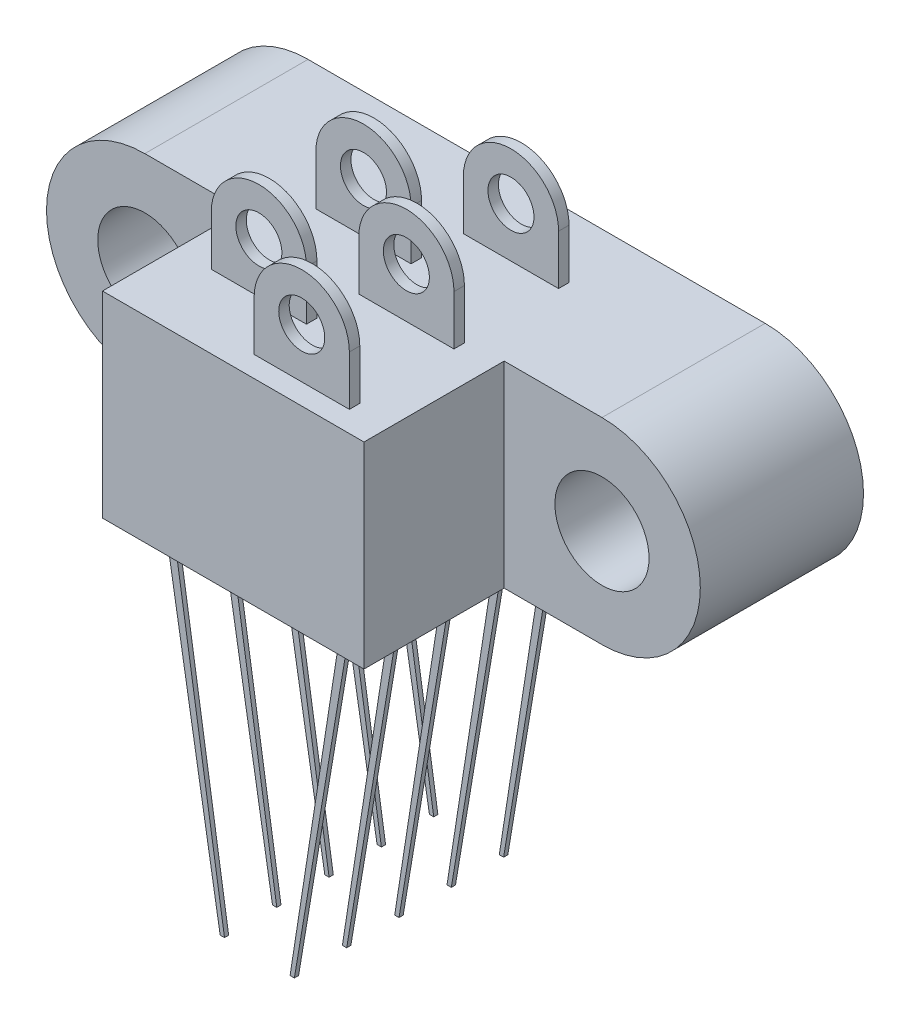
from build123d import *

# Parameters (mm, degrees)
SKETCH1_R                 = 1.143
BOSS_EXTRUDE1_DEPTH       = 3.9624
SKETCH2_W                 = 6.35
SKETCH2_H                 = 4.7752
BOSS_EXTRUDE2_DEPTH       = 3.4036
BOSS_EXTRUDE3_DEPTH       = 0.127
BOSS_EXTRUDE3_DEPTH_BACK  = 0.127
SKETCH3_R                 = 0.5588
BOSS_EXTRUDE4_DEPTH       = 0.127
BOSS_EXTRUDE4_DEPTH_BACK  = 0.127
SKETCH4_R                 = 0.5588
BOSS_EXTRUDE5_DEPTH       = 0.127
BOSS_EXTRUDE5_DEPTH_BACK  = 0.127
SKETCH5_R                 = 0.5588
BOSS_EXTRUDE6_DEPTH       = 0.127
BOSS_EXTRUDE6_DEPTH_BACK  = 0.127
SKETCH7_R                 = 0.5588
BOSS_EXTRUDE7_DEPTH       = 0.127
BOSS_EXTRUDE7_DEPTH_BACK  = 0.127
SKETCH6_R                 = 0.5588
BOSS_EXTRUDE8_DEPTH       = 0.0508
BOSS_EXTRUDE8_DEPTH_BACK  = 0.0508
BOSS_EXTRUDE11_DEPTH      = 0.0508
BOSS_EXTRUDE11_DEPTH_BACK = 0.0508
BOSS_EXTRUDE12_DEPTH      = 0.0508
BOSS_EXTRUDE12_DEPTH_BACK = 0.0508
BOSS_EXTRUDE13_DEPTH      = 0.0508
BOSS_EXTRUDE13_DEPTH_BACK = 0.0508
BOSS_EXTRUDE14_DEPTH      = 0.0508
BOSS_EXTRUDE14_DEPTH_BACK = 0.0508


with BuildPart() as part:
    # Sketch1 → Boss-Extrude1 (new body)
    with BuildSketch(Plane.XY):
        with BuildLine():
            Line((-5.5499, 2.3876), (5.5499, 2.3876))
            ThreePointArc((5.5499, 2.3876), (7.9375, 0), (5.5499, -2.3876))
            Line((5.5499, -2.3876), (-5.5499, -2.3876))
            ThreePointArc((-5.5499, -2.3876), (-7.9375, 0), (-5.5499, 2.3876))
        make_face()
        with Locations((-5.5499, 0)):
            Circle(SKETCH1_R, mode=Mode.SUBTRACT)
        with Locations((5.5499, 0)):
            Circle(SKETCH1_R, mode=Mode.SUBTRACT)
    extrude(amount=BOSS_EXTRUDE1_DEPTH)

    # Sketch2 → Boss-Extrude2 (add)
    with BuildSketch(Plane.XY.offset(3.9624)):
        Rectangle(SKETCH2_W, SKETCH2_H)
    extrude(amount=BOSS_EXTRUDE2_DEPTH)

    # Sketch3 → Boss-Extrude3 (add, two sides: drawn at the far end of the back side and taken through both)
    with BuildSketch(Plane(origin=(0, 0, 1.651), x_dir=(-1, 0, 0), z_dir=(0, 0, -1)).offset(-BOSS_EXTRUDE3_DEPTH_BACK)):
        with BuildLine():
            Line((-2.3114, 3.5941), (-2.3114, 2.3876))
            Line((-2.3114, 2.3876), (0, 2.3876))
            Line((0, 2.3876), (0, 3.5941))
            ThreePointArc((0, 3.5941), (-1.1557, 4.7498), (-2.3114, 3.5941))
        make_face()
        with Locations((-1.1557, 3.5941)):
            Circle(SKETCH3_R, mode=Mode.SUBTRACT)
    extrude(amount=BOSS_EXTRUDE3_DEPTH + BOSS_EXTRUDE3_DEPTH_BACK)

    # Sketch4 → Boss-Extrude4 (add, two sides: drawn at the far end of the back side and taken through both)
    with BuildSketch(Plane(origin=(0, 0, 2.921), x_dir=(-1, 0, 0), z_dir=(0, 0, -1)).offset(-BOSS_EXTRUDE4_DEPTH_BACK)):
        with BuildLine():
            Line((2.3114, 3.5941), (2.3114, 2.3876))
            Line((2.3114, 2.3876), (0, 2.3876))
            Line((0, 2.3876), (0, 3.5941))
            ThreePointArc((0, 3.5941), (1.1557, 4.7498), (2.3114, 3.5941))
        make_face()
        with Locations(Location((1.1557, 3.5941, 0), (0, 0, 180))):
            Circle(SKETCH4_R, mode=Mode.SUBTRACT)
    extrude(amount=BOSS_EXTRUDE4_DEPTH + BOSS_EXTRUDE4_DEPTH_BACK)

    # Sketch5 → Boss-Extrude5 (add, two sides: drawn at the far end of the back side and taken through both)
    with BuildSketch(Plane(origin=(0, 0, 4.191), x_dir=(-1, 0, 0), z_dir=(0, 0, -1)).offset(-BOSS_EXTRUDE5_DEPTH_BACK)):
        with BuildLine():
            Line((-2.3114, 3.5941), (-2.3114, 2.3876))
            Line((-2.3114, 2.3876), (0, 2.3876))
            Line((0, 2.3876), (0, 3.5941))
            ThreePointArc((0, 3.5941), (-1.1557, 4.7498), (-2.3114, 3.5941))
        make_face()
        with Locations((-1.1557, 3.5941)):
            Circle(SKETCH5_R, mode=Mode.SUBTRACT)
    extrude(amount=BOSS_EXTRUDE5_DEPTH + BOSS_EXTRUDE5_DEPTH_BACK)

    # Sketch7 → Boss-Extrude6 (add, two sides: drawn at the far end of the back side and taken through both)
    with BuildSketch(Plane(origin=(0, 0, 5.461), x_dir=(-1, 0, 0), z_dir=(0, 0, -1)).offset(-BOSS_EXTRUDE6_DEPTH_BACK)):
        with BuildLine():
            Line((2.3114, 2.3876), (2.3114, 3.5941))
            ThreePointArc((2.3114, 3.5941), (1.1557, 4.7498), (0, 3.5941))
            Line((0, 3.5941), (0, 2.3876))
            Line((0, 2.3876), (2.3114, 2.3876))
        make_face()
        with Locations(Location((1.1557, 3.5941, 0), (0, 0, 180))):
            Circle(SKETCH7_R, mode=Mode.SUBTRACT)
    extrude(amount=BOSS_EXTRUDE6_DEPTH + BOSS_EXTRUDE6_DEPTH_BACK)

    # Sketch6 → Boss-Extrude7 (add, two sides: drawn at the far end of the back side and taken through both)
    with BuildSketch(Plane(origin=(0, 0, 6.731), x_dir=(-1, 0, 0), z_dir=(0, 0, -1)).offset(-BOSS_EXTRUDE7_DEPTH_BACK)):
        with BuildLine():
            Line((-2.3114, 3.5941), (-2.3114, 2.3876))
            Line((-2.3114, 2.3876), (0, 2.3876))
            Line((0, 2.3876), (0, 3.5941))
            ThreePointArc((0, 3.5941), (-1.1557, 4.7498), (-2.3114, 3.5941))
        make_face()
        with Locations((-1.1557, 3.5941)):
            Circle(SKETCH6_R, mode=Mode.SUBTRACT)
    extrude(amount=BOSS_EXTRUDE7_DEPTH + BOSS_EXTRUDE7_DEPTH_BACK)

    # Sketch8 → Boss-Extrude8 (add, two sides: drawn at the far end of the back side and taken through both)
    with BuildSketch(Plane(origin=(0, 0, 1.651), x_dir=(-1, 0, 0), z_dir=(0, 0, -1)).offset(-BOSS_EXTRUDE8_DEPTH_BACK)):
        Polygon((2.228681211, -2.3876), (2.028101851, -2.3876), (0.796265448, -10.3124), (0.900870757, -10.3124), align=None)
        Polygon((-0.900870757, -10.3124), (-0.796265448, -10.3124), (-2.028101851, -2.3876), (-2.228681211, -2.3876), align=None)
    extrude(amount=BOSS_EXTRUDE8_DEPTH + BOSS_EXTRUDE8_DEPTH_BACK)

    # Sketch11 → Boss-Extrude11 (add, two sides: drawn at the far end of the back side and taken through both)
    with BuildSketch(Plane(origin=(0, 0, 4.191), x_dir=(-1, 0, 0), z_dir=(0, 0, -1)).offset(-BOSS_EXTRUDE11_DEPTH_BACK)):
        Polygon((2.228681211, -2.3876), (0.900870757, -10.3124), (0.796265448, -10.3124), (2.028101851, -2.3876), align=None)
        Polygon((-0.900870757, -10.3124), (-0.796265448, -10.3124), (-2.028101851, -2.3876), (-2.228681211, -2.3876), align=None)
    extrude(amount=BOSS_EXTRUDE11_DEPTH + BOSS_EXTRUDE11_DEPTH_BACK)

    # Sketch12 → Boss-Extrude12 (add, two sides: drawn at the far end of the back side and taken through both)
    with BuildSketch(Plane(origin=(0, 0, 6.731), x_dir=(-1, 0, 0), z_dir=(0, 0, -1)).offset(-BOSS_EXTRUDE12_DEPTH_BACK)):
        Polygon((2.228681211, -2.3876), (0.900870757, -10.3124), (0.796265448, -10.3124), (2.028101851, -2.3876), align=None)
        Polygon((-0.900870757, -10.3124), (-0.796265448, -10.3124), (-2.028101851, -2.3876), (-2.228681211, -2.3876), align=None)
    extrude(amount=BOSS_EXTRUDE12_DEPTH + BOSS_EXTRUDE12_DEPTH_BACK)

    # Sketch13 → Boss-Extrude13 (add, two sides: drawn at the far end of the back side and taken through both)
    with BuildSketch(Plane(origin=(0, 0, 2.921), x_dir=(-1, 0, 0), z_dir=(0, 0, -1)).offset(-BOSS_EXTRUDE13_DEPTH_BACK)):
        Polygon((0.900870757, -10.3124), (0.796265448, -10.3124), (2.028101851, -2.3876), (2.228681211, -2.3876), align=None)
        Polygon((-0.900870757, -10.3124), (-0.796265448, -10.3124), (-2.028101851, -2.3876), (-2.228681211, -2.3876), align=None)
    extrude(amount=BOSS_EXTRUDE13_DEPTH + BOSS_EXTRUDE13_DEPTH_BACK)

    # Sketch15 → Boss-Extrude14 (add, two sides: drawn at the far end of the back side and taken through both)
    with BuildSketch(Plane(origin=(0, 0, 5.461), x_dir=(-1, 0, 0), z_dir=(0, 0, -1)).offset(-BOSS_EXTRUDE14_DEPTH_BACK)):
        Polygon((-0.900870757, -10.3124), (-2.228681211, -2.3876), (-2.028101851, -2.3876), (-0.796265448, -10.3124), align=None)
        Polygon((0.796265448, -10.3124), (0.900870757, -10.3124), (2.228681211, -2.3876), (2.028101851, -2.3876), align=None)
    extrude(amount=BOSS_EXTRUDE14_DEPTH + BOSS_EXTRUDE14_DEPTH_BACK)


solid = part.part
